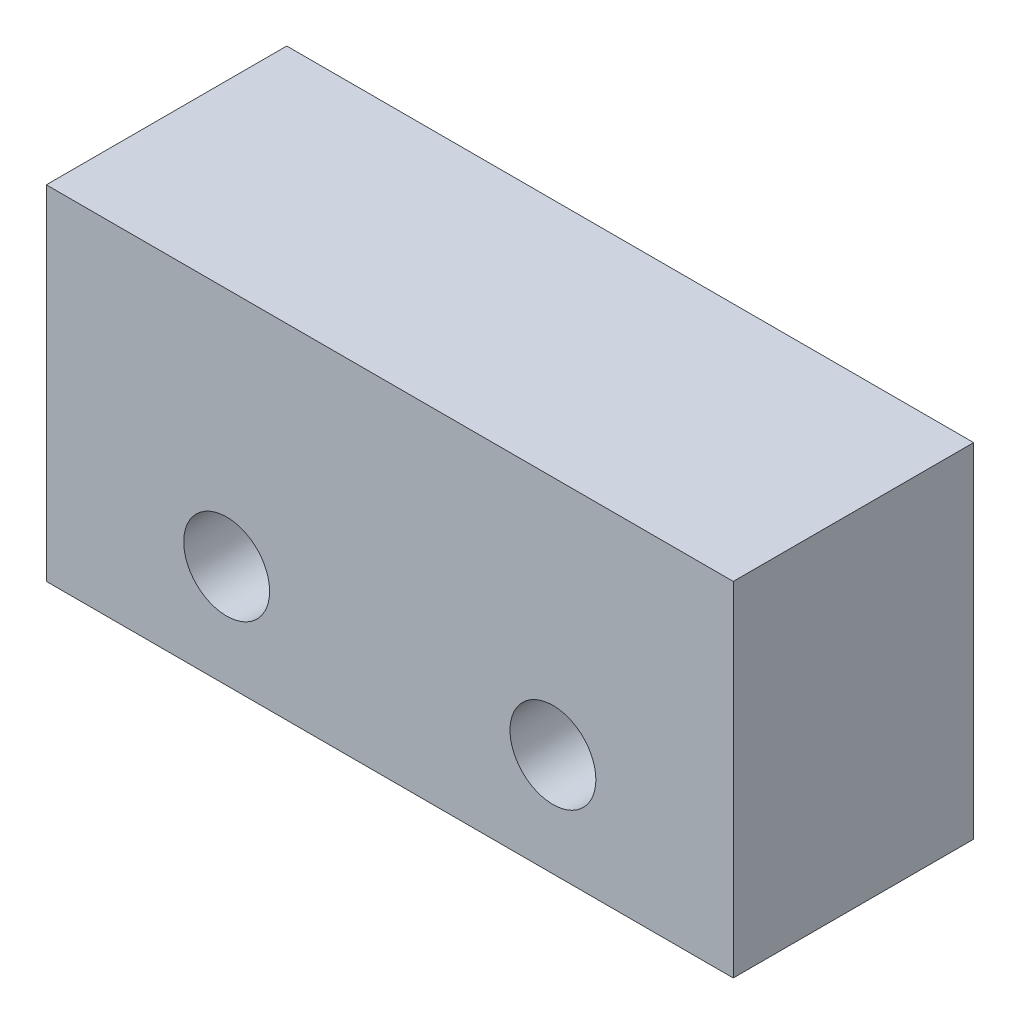
from build123d import *

# Parameters (mm, degrees)
CROQUIS1_W              = 20
CROQUIS1_H              = 7
SALIENTE_EXTRUIR1_DEPTH = 10
TALADRO1_D              = 2.5


with BuildPart() as part:
    # Croquis1 → Saliente-Extruir1 (new body)
    with BuildSketch(Plane(origin=(0, 0, 0), x_dir=(1, 0, 0), z_dir=(0, 1, 0))):
        Rectangle(CROQUIS1_W, CROQUIS1_H)
    extrude(amount=SALIENTE_EXTRUIR1_DEPTH)

    # Taladro1 (through all)
    with Locations(Plane.XY.offset(3.5)):
        with Locations((-4.75, 3), (4.75, 3)):
            Hole(TALADRO1_D / 2)


solid = part.part
